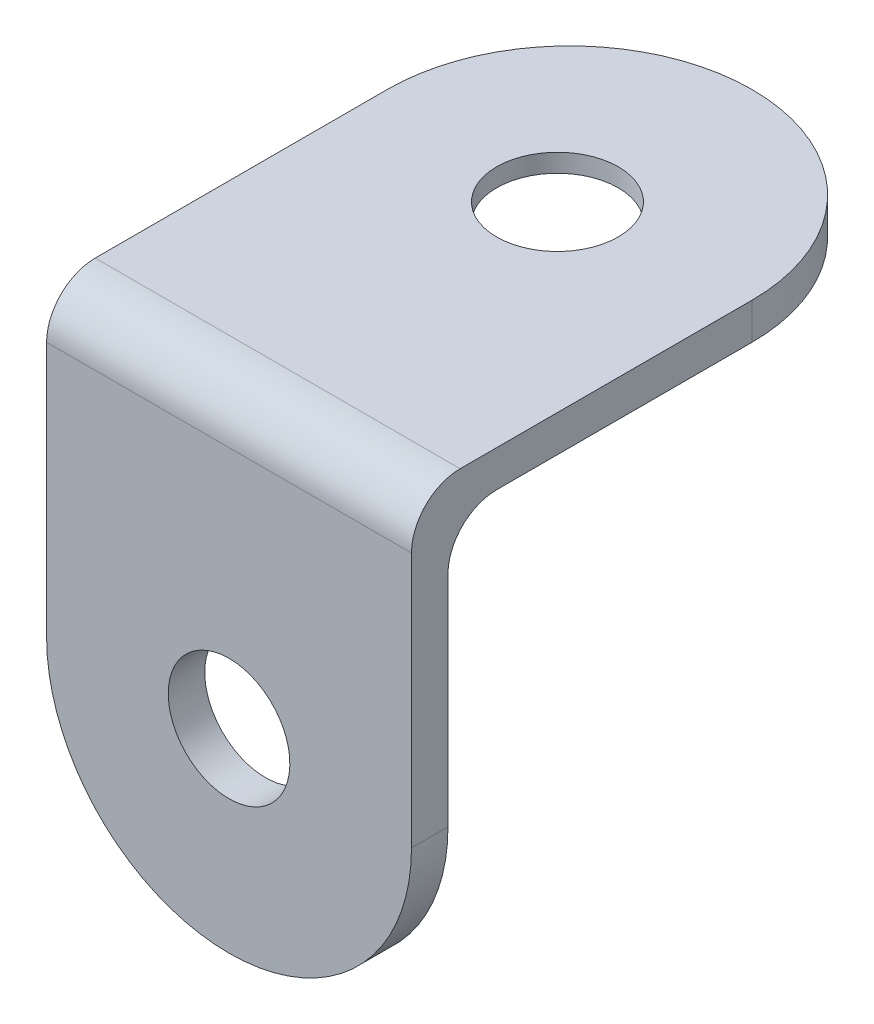
from build123d import *

# Parameters (mm, degrees)
SKETCH1_R           = 2.5
BOSS_EXTRUDE1_DEPTH = 1.5
CIRPATTERN1_COUNT   = 2
CIRPATTERN1_ANGLE   = 90
FILLET1_R           = 2
SKETCH3_R           = 2.5
CUT_EXTRUDE2_DEPTH  = 0.75
CUT_EXTRUDE2_DRAFT  = -60


with BuildPart() as part:
    # Sketch1 → Boss-Extrude1 (new body)
    with BuildSketch(Plane(origin=(0, 0, 0), x_dir=(1, 0, 0), z_dir=(0, 1, 0))):
        with BuildLine():
            Line((-7.5, 0), (7.5, 0))
            Line((7.5, 0), (7.5, 12.5))
            ThreePointArc((7.5, 12.5), (0, 20), (-7.5, 12.5))
            Line((-7.5, 12.5), (-7.5, 0))
        make_face()
        with Locations(Location((0, 12, 0), (0, 0, 270))):
            Circle(SKETCH1_R, mode=Mode.SUBTRACT)
    boss_extrude1 = extrude(amount=BOSS_EXTRUDE1_DEPTH)

    # CirPattern1: Boss-Extrude1 ×2 about axis
    cirpattern1_axis = Axis((-7.5, 1.5, 0), (-1, 0, 0))
    for i in range(1, CIRPATTERN1_COUNT):
        add(boss_extrude1.rotate(cirpattern1_axis, i * CIRPATTERN1_ANGLE / (CIRPATTERN1_COUNT - 1)))

    # Fillet1
    fillet1_edges = [part.edges().sort_by_distance(p)[0] for p in [
        (0, 1.5, 1.5),
        (0, 0, 0),
    ]]
    fillet(fillet1_edges, radius=FILLET1_R)


with BuildPart() as cut_extrude2_tool:
    # Sketch3 → Cut-Extrude2 (with draft: the straight prism first)
    with BuildSketch(Plane(origin=(0, 0.75, 0), x_dir=(-1, 0, 0), z_dir=(0, -1, 0))):
        with Locations(Location((0, 12, 0), (0, 0, 90))):
            Circle(SKETCH3_R)
    extrude(amount=CUT_EXTRUDE2_DEPTH)
    # Cut-Extrude2: the draft: its side faces are tilted about the plane it starts from
    cut_extrude2_sides = [cut_extrude2_tool.faces().sort_by_distance(p)[0] for p in [
        (0, 0.375, -9.5),
    ]]
    draft(cut_extrude2_sides, Plane(origin=(0, 0.75, 0), x_dir=(-1, 0, 0), z_dir=(0, -1, 0)), CUT_EXTRUDE2_DRAFT)


with BuildPart() as part_1:
    add(part.part)

    # Cut-Extrude2: cut by cut_extrude2_tool
    add(cut_extrude2_tool.part, mode=Mode.SUBTRACT)


solid = part_1.part
